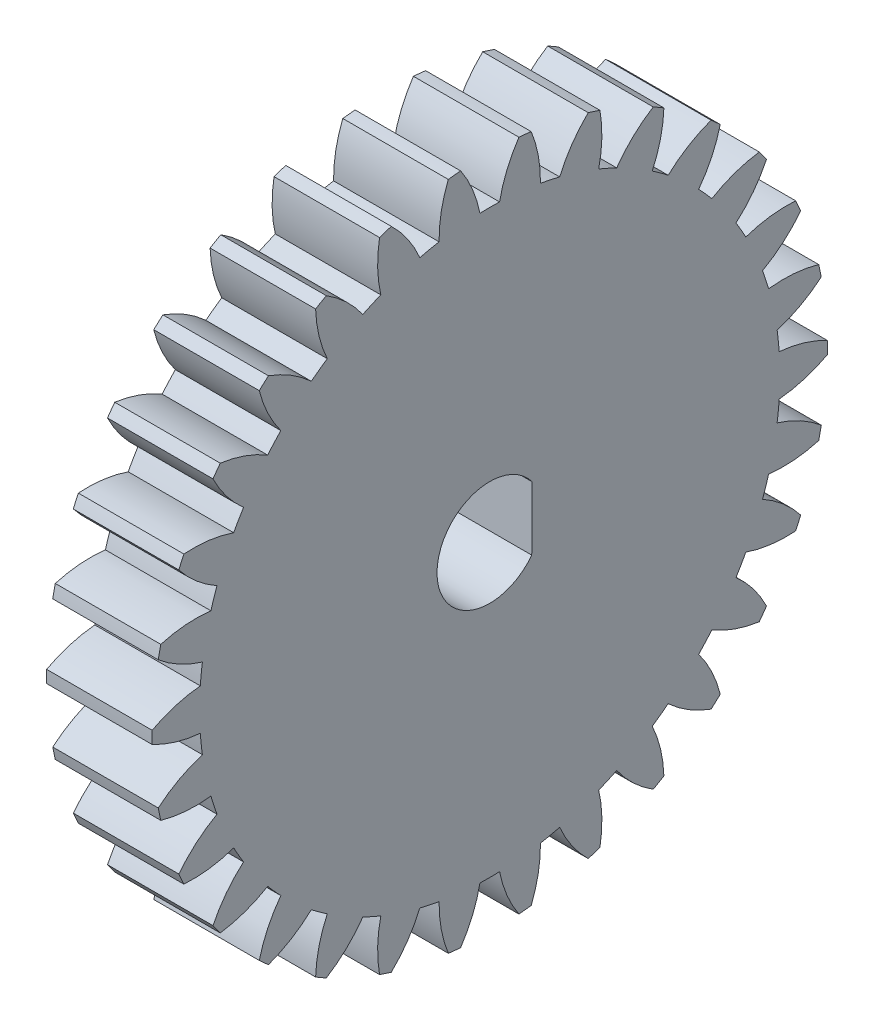
from build123d import *

# Parameters (mm, degrees)
BASPROSKE_W        = 5
BASPROSKE_H        = 16
TOOTHCUT_DEPTH     = 24.173260453
TEETHCUTS_COUNT    = 30
TEETHCUTS_ANGLE    = 348
BORSKE_R           = 2.5
BORE_DEPTH         = 50.0000508
ESQUISSE1_R        = 3.356867485
BOSS_EXTRU_1_DEPTH = 5


with BuildPart() as part:
    # BasProSke → Base-Revolve (revolve)
    with BuildSketch(Plane(origin=(0, 0, 0), x_dir=(1, 0, 0), z_dir=(0, 1, 0)), mode=Mode.PRIVATE) as base_revolve_sk:
        with Locations((2.5, 8)):
            Rectangle(BASPROSKE_W, BASPROSKE_H)
    revolve(base_revolve_sk.sketch.rotate(Axis((-10, 0, 0), (1, 0, 0)), 180), axis=Axis((-10, 0, 0), (1, 0, 0)))

    # TooCutSke → ToothCut (cut, through all)
    with BuildSketch(Plane(origin=(0, 0, 0), x_dir=(0, 0, -1), z_dir=(1, 0, 0))):
        with BuildLine():
            ThreePointArc((0.466400716, 13.741086979), (0, 13.749), (-0.466400716, 13.741086979))
            ThreePointArc((-0.466400716, 13.741086979), (-0.819142092, 14.899954875), (-1.3974676, 15.964351834))
            ThreePointArc((-1.3974676, 15.964351834), (0, 16.0254), (1.3974676, 15.964351834))
            ThreePointArc((1.3974676, 15.964351834), (0.819142092, 14.899954875), (0.466400716, 13.741086979))
        make_face()
    toothcut = extrude(amount=TOOTHCUT_DEPTH, mode=Mode.SUBTRACT)

    # TeethCuts: ToothCut ×30 about axis
    teethcuts_axis = Axis((-10, 0, 0), (1, 0, 0))
    for i in range(1, TEETHCUTS_COUNT):
        add(toothcut.rotate(teethcuts_axis, i * TEETHCUTS_ANGLE / (TEETHCUTS_COUNT - 1)), mode=Mode.SUBTRACT)

    # BorSke → Bore (cut, symmetric)
    with BuildSketch(Plane(origin=(0, 0, 0), x_dir=(0, 0, -1), z_dir=(1, 0, 0))):
        with Locations(Location((0, 0, 0), (0, 0, 180))):
            Circle(BORSKE_R)
    extrude(amount=BORE_DEPTH, both=True, mode=Mode.SUBTRACT)

    # Esquisse1 → Boss.-Extru.1 (add)
    with BuildSketch(Plane(origin=(5, 0, 0), x_dir=(0, 0, -1), z_dir=(1, 0, 0))):
        Circle(ESQUISSE1_R)
        with BuildLine():
            Line((1.989182734, -1.514315704), (2.010613168, 1.485743817))
            ThreePointArc((2.010613168, 1.485743817), (-2.499936218, 0.017857885), (1.989182734, -1.514315704))
        make_face(mode=Mode.SUBTRACT)
    extrude(amount=-BOSS_EXTRU_1_DEPTH)


solid = part.part
